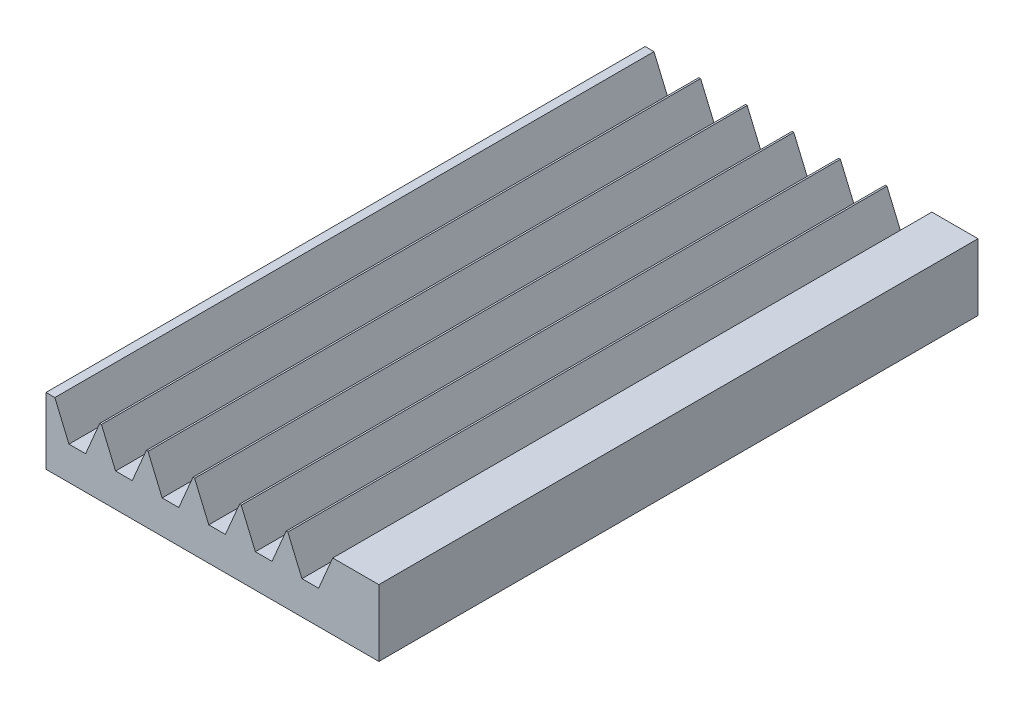
from build123d import *

# Parameters (mm, degrees)
BOSS_EXTRUDE1_DEPTH      = 5
BOSS_EXTRUDE1_DEPTH_BACK = 13
SKETCH1_W                = 10
SKETCH1_H                = 2
CUT_EXTRUDE1_DEPTH       = 18
LPATTERN2_COUNT          = 6
LPATTERN2_PITCH          = 1.4


with BuildPart() as part:
    # Sketch1 → Boss-Extrude1 (new, two sides: drawn at the far end of the back side and taken through both)
    with BuildSketch(Plane.XY.offset(-BOSS_EXTRUDE1_DEPTH_BACK)):
        with Locations((5, 1)):
            Rectangle(SKETCH1_W, SKETCH1_H)
    extrude(amount=BOSS_EXTRUDE1_DEPTH + BOSS_EXTRUDE1_DEPTH_BACK)

    # Sketch3 → Cut-Extrude1 (cut)
    with BuildSketch(Plane.XY.offset(5)):
        Polygon((0.689824634, 1), (1.189824634, 1), (1.619628875, 2.012555339), (0.260020392, 2.012555339), align=None)
    cut_extrude1 = extrude(amount=-CUT_EXTRUDE1_DEPTH, mode=Mode.SUBTRACT)

    # LPattern2: Cut-Extrude1 ×6
    with Locations(*[(i * LPATTERN2_PITCH, 0, 0) for i in range(1, LPATTERN2_COUNT)]):
        add(cut_extrude1, mode=Mode.SUBTRACT)


solid = part.part
